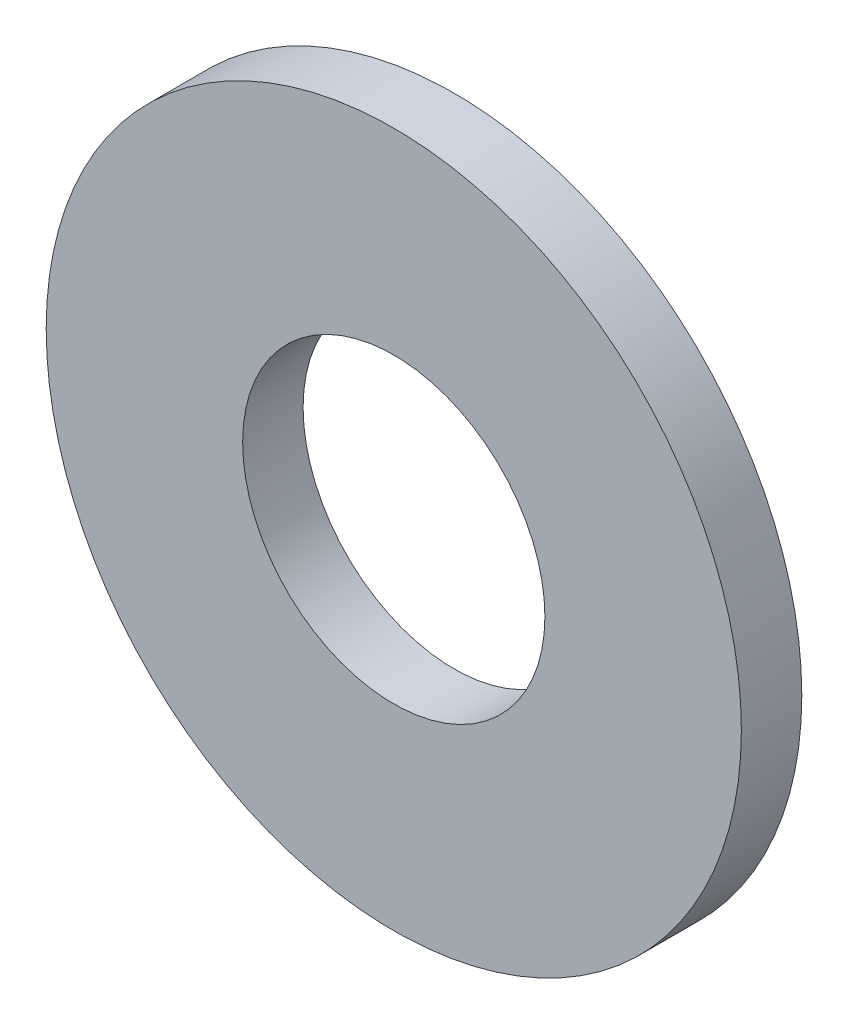
from build123d import *

# Parameters (mm, degrees)
ESQUISSE1_R        = 5.75
ESQUISSE1_R_2      = 2.5
BOSS_EXTRU_1_DEPTH = 1


with BuildPart() as part:
    # Esquisse1 → Boss.-Extru.1 (new body)
    with BuildSketch(Plane.XY):
        Circle(ESQUISSE1_R)
        Circle(ESQUISSE1_R_2, mode=Mode.SUBTRACT)
    extrude(amount=BOSS_EXTRU_1_DEPTH)


solid = part.part
